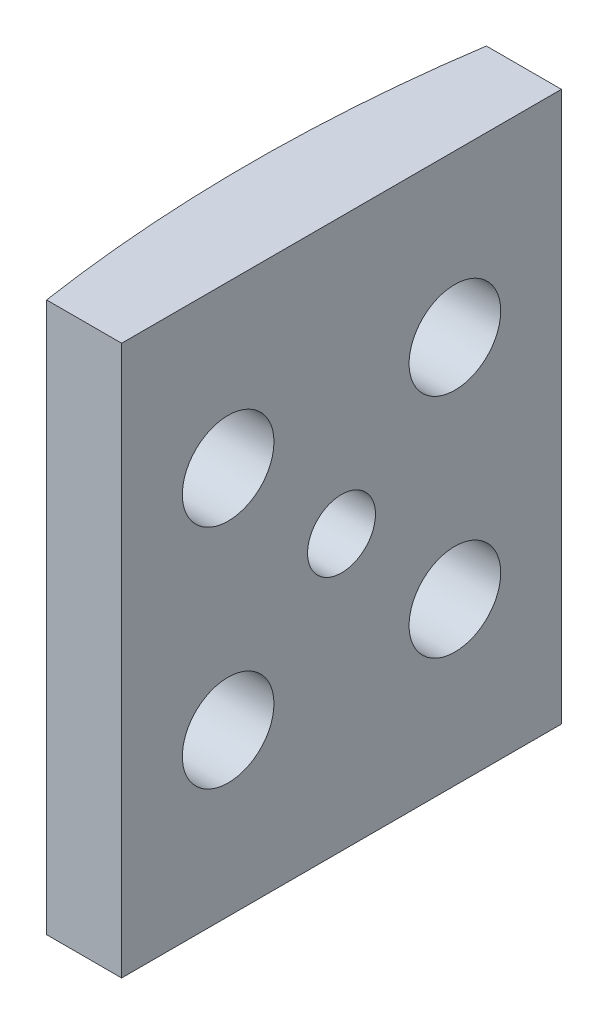
from build123d import *

# Parameters (mm, degrees)
BOSS_EXTRUDE1_DEPTH = 30
SKETCH2_R           = 1.853585504
SKETCH2_R_2         = 2.5
CUT_EXTRUDE1_DEPTH  = 18


with BuildPart() as part:
    # Sketch1 → Boss-Extrude1 (new body)
    with BuildSketch(Plane(origin=(0, 0, 0), x_dir=(1, 0, 0), z_dir=(0, 1, 0))):
        with BuildLine():
            Line((-79.094879733, 12), (-75, 12))
            Line((-75, 12), (-75, -12))
            Line((-75, -12), (-79.094879733, -12))
            ThreePointArc((-79.094879733, -12), (-80, 0), (-79.094879733, 12))
        make_face()
    extrude(amount=BOSS_EXTRUDE1_DEPTH)

    # Sketch2 → Cut-Extrude1 (cut)
    with BuildSketch(Plane(origin=(-75, 0, 0), x_dir=(0, 0, -1), z_dir=(1, 0, 0))):
        with Locations((0, 15)):
            Circle(SKETCH2_R)
        with Locations((6.187184335, 21.187184335)):
            Circle(SKETCH2_R_2)
        with Locations((6.187184335, 8.812815665)):
            Circle(SKETCH2_R_2)
        with Locations((-6.187184335, 8.812815665)):
            Circle(SKETCH2_R_2)
        with Locations((-6.187184335, 21.187184335)):
            Circle(SKETCH2_R_2)
    extrude(amount=-CUT_EXTRUDE1_DEPTH, mode=Mode.SUBTRACT)


solid = part.part
